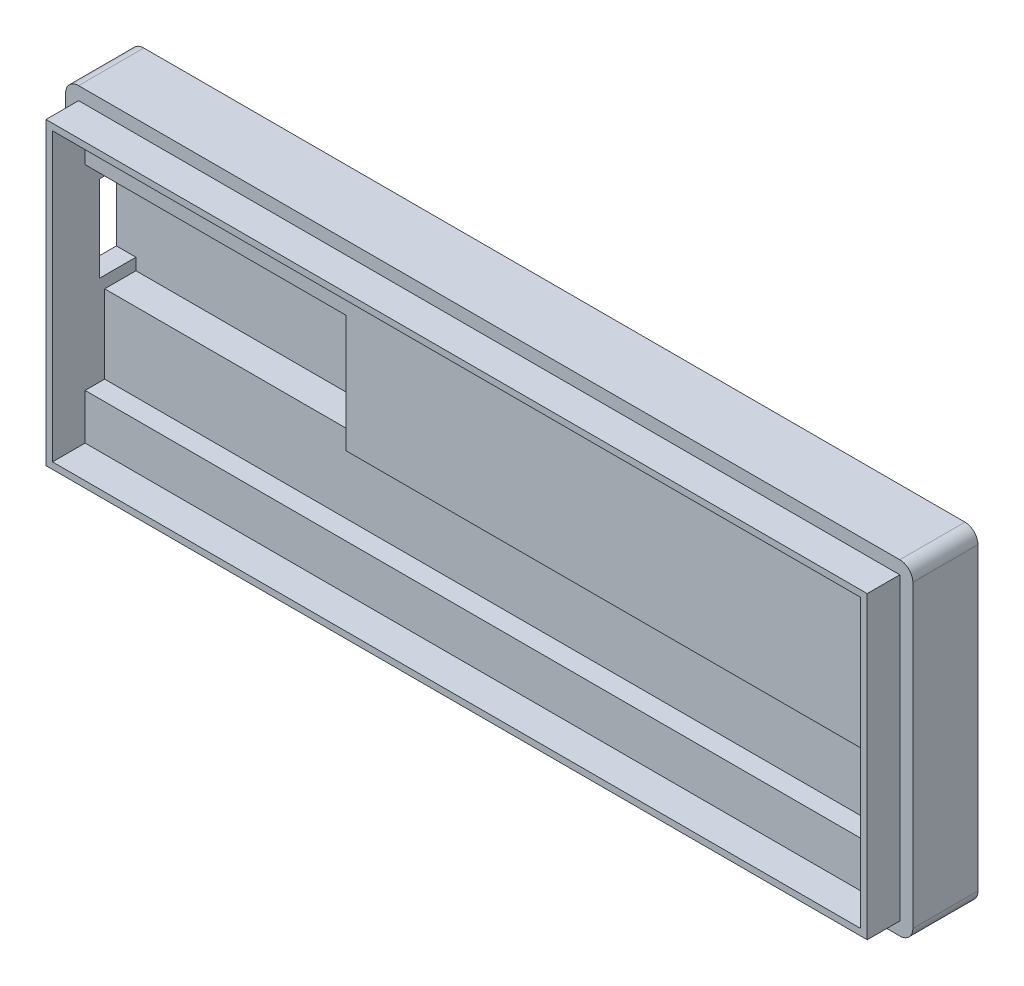
from build123d import *

# Parameters (mm, degrees)
SKICA2_W                  = 130
SKICA2_H                  = 50
P_IDAT_VYSUNUT_M1_DEPTH   = 10
P_IDAT_START              = -10
SKICA2_7_W                = 122
SKICA2_7_H                = 12
P_IDAT_VYSUNUT_M3_DEPTH   = 7
SKICA2_8_W                = 40
SKICA2_8_H                = 18
P_IDAT_VYSUNUT_M4_DEPTH   = 2.2
SKICA3_W                  = 5.6
SKICA3_H                  = 13.2
ODEBRAT_VYSUNUT_M12_DEPTH = 11
SKICA4_W                  = 126
SKICA4_H                  = 46
SKICA4_W_2                = 124
SKICA4_H_2                = 44
P_IDAT_VYSUNUT_M5_DEPTH   = 5
ZAOBLIT1_R                = 2


with BuildPart() as part:
    # Skica2 → Přidat vysunutím1 (new body)
    with BuildSketch(Plane.XY):
        with Locations((-0.5, 0)):
            Rectangle(SKICA2_W, SKICA2_H)
        Polygon((-62.5, -15), (-62.5, -3), (-62.5, 15), (-22.5, 15), (-22.5, -3), (59.5, -3), (59.5, -15), align=None, mode=Mode.SUBTRACT)
    extrude(amount=-P_IDAT_VYSUNUT_M1_DEPTH)

    # Skica2<7> → Přidat vysunutím3 (add)
    with BuildSketch(Plane.XY.offset(P_IDAT_START)):
        with Locations((-1.5, -9)):
            Rectangle(SKICA2_7_W, SKICA2_7_H)
    extrude(amount=P_IDAT_VYSUNUT_M3_DEPTH)

    # Skica2<8> → Přidat vysunutím4 (add)
    with BuildSketch(Plane.XY.offset(P_IDAT_START)):
        with Locations((-42.5, 6)):
            Rectangle(SKICA2_8_W, SKICA2_8_H)
    extrude(amount=P_IDAT_VYSUNUT_M4_DEPTH)

    # Skica3 → Odebrat vysunutím12 (cut)
    with BuildSketch(Plane.ZY.offset(65.5)):
        with Locations((-5, 5.4)):
            Rectangle(SKICA3_W, SKICA3_H)
    extrude(amount=-ODEBRAT_VYSUNUT_M12_DEPTH, mode=Mode.SUBTRACT)

    # Skica4 → Přidat vysunutím5 (add)
    with BuildSketch(Plane.XY):
        with Locations((-0.5, 0)):
            Rectangle(SKICA4_W, SKICA4_H)
        with Locations((-0.5, 0)):
            Rectangle(SKICA4_W_2, SKICA4_H_2, mode=Mode.SUBTRACT)
    extrude(amount=P_IDAT_VYSUNUT_M5_DEPTH)

    # Zaoblit1
    zaoblit1_edges = [part.edges().sort_by_distance(p)[0] for p in [
        (-65.5, -25, -5),
        (-65.5, 25, -5),
        (64.5, 25, -5),
        (64.5, -25, -5),
    ]]
    fillet(zaoblit1_edges, radius=ZAOBLIT1_R)


solid = part.part
